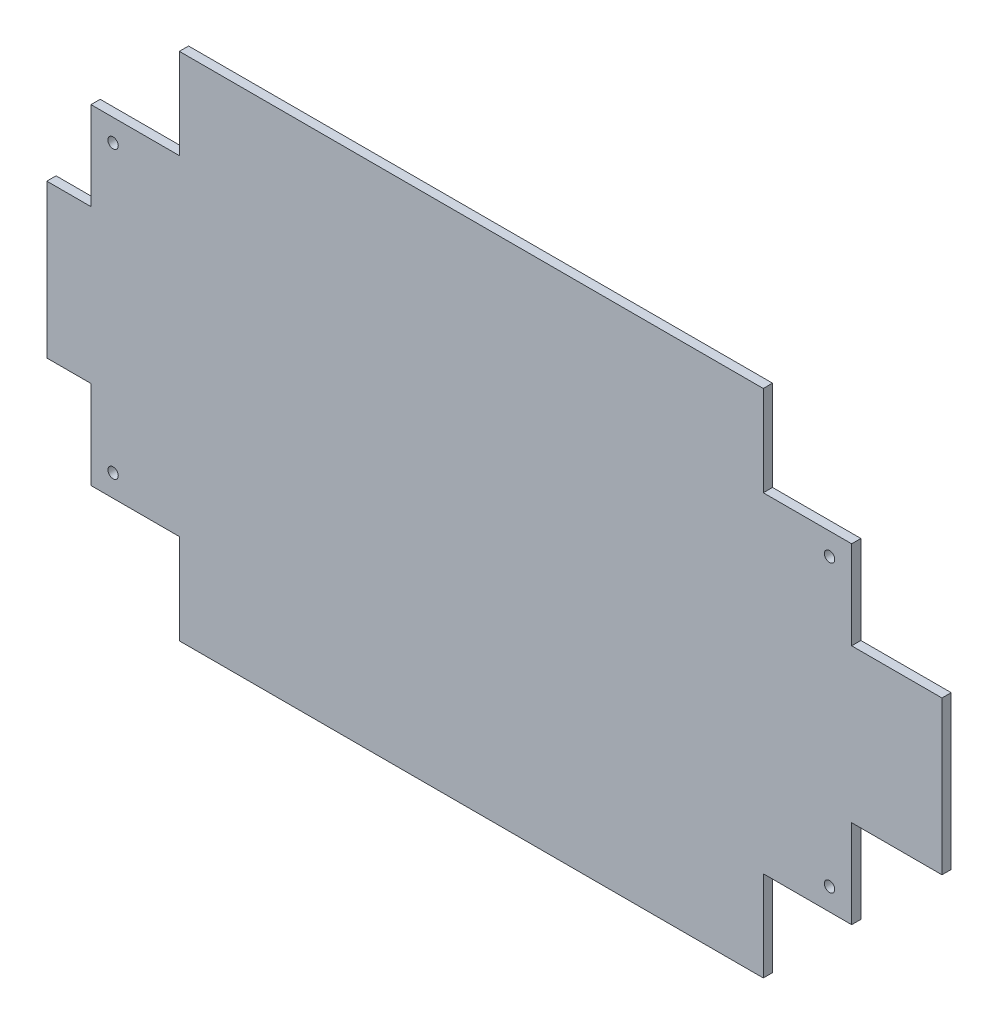
from build123d import *

# Parameters (mm, degrees)
BOSS_EXTRU_1_DEPTH      = 6.35
ESQUISSE2_W             = 401.8
ESQUISSE2_H             = 6.35
ENL_V_MAT_EXTRU_1_DEPTH = 643.307344657
D_GAGEMENT_1_41_D       = 7.14248
ESQUISSE5_W             = 401.8
ESQUISSE5_H             = 1.35
BOSS_EXTRU_2_DEPTH      = 6.35


with BuildPart() as part:
    # Esquisse1 → Boss.-Extru.1 (new body)
    with BuildSketch(Plane.XY):
        Polygon((-615.95, 52.7), (-615.95, -52.7), (-553.8, -52.7), (-553.8, -113.5), (-493, -113.5), (-493, -174.3), (-91.2, -174.3), (-91.2, -113.5), (-30.4, -113.5), (-30.4, -52.7), (0, -52.7), (0, 52.7), (-30.4, 52.7), (-30.4, 113.5), (-91.2, 113.5), (-91.2, 182), (-493, 182), (-493, 113.5), (-553.8, 113.5), (-553.8, 52.7), align=None)
    extrude(amount=BOSS_EXTRU_1_DEPTH)

    # Esquisse2 → Enlèv. mat.-Extru.1 (cut, through all)
    with BuildSketch(Plane.XY.offset(6.35)):
        with Locations((-292.1, 178.825)):
            Rectangle(ESQUISSE2_W, ESQUISSE2_H)
    extrude(amount=-ENL_V_MAT_EXTRU_1_DEPTH, mode=Mode.SUBTRACT)

    # Dégagement 1/41 (through all)
    with Locations(Plane(origin=(0, 0, 0), x_dir=(-1, 0, 0), z_dir=(0, 0, -1))):
        with Locations((45.6, 98.3), (45.6, -98.3), (538.6, -98.3), (538.6, 98.3)):
            Hole(D_GAGEMENT_1_41_D / 2)

    # Esquisse5 → Boss.-Extru.2 (add, through all)
    with BuildSketch(Plane.XY.offset(6.35)):
        with Locations((-292.1, -174.975)):
            Rectangle(ESQUISSE5_W, ESQUISSE5_H)
    extrude(amount=-BOSS_EXTRU_2_DEPTH)


with BuildPart() as body_2:
    # Symétrie1: mirrored copy
    add(part.part.mirror(Plane(origin=(0, -52.7, 6.35), x_dir=(0, 0, 1), z_dir=(-1, 0, 0))))


solid = body_2.part
